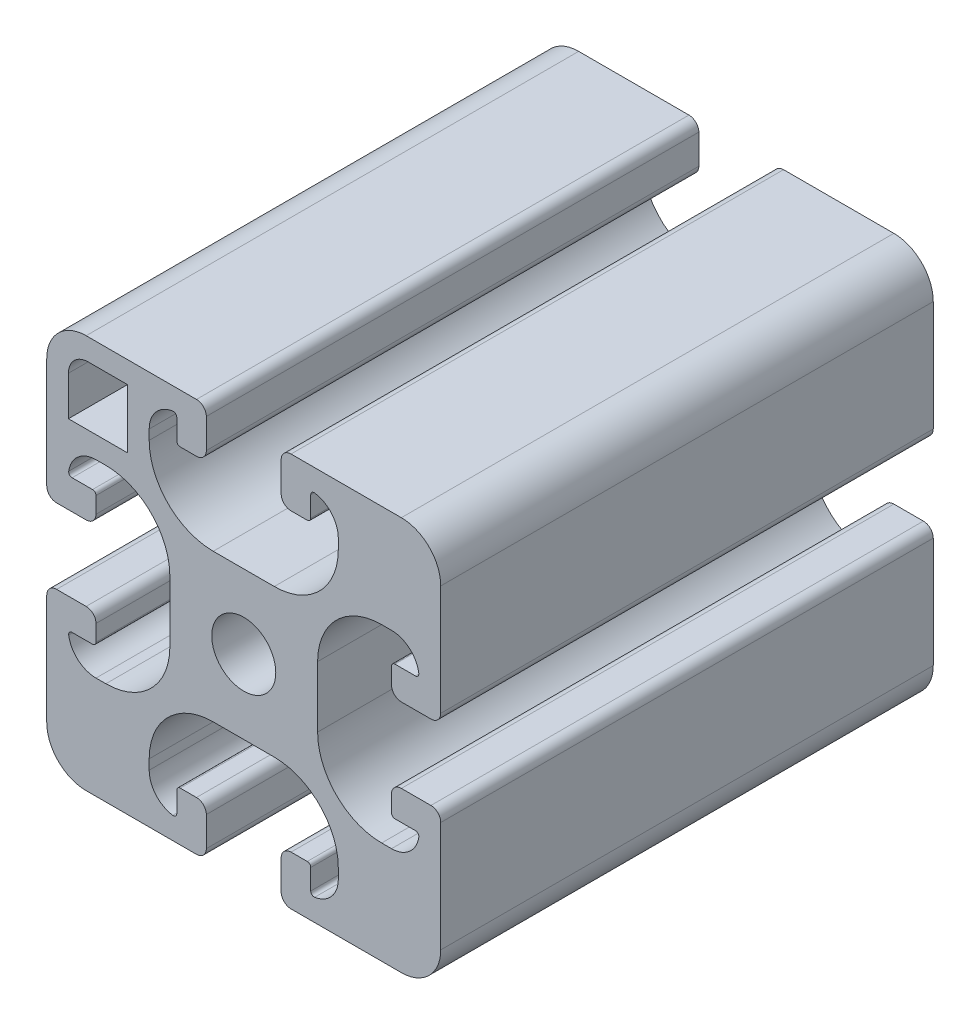
from build123d import *
from build123d.topology import SkipClean

# Parameters (mm, degrees)
Y_KSEKLIK_EKSTR_ZYON1_DEPTH = 50


with BuildPart() as part:
    # Çizim1 → Yükseklik-Ekstrüzyon1 (new body)
    # profile 1 of 4: a face of its own
    with SkipClean():  # the faces are left unmerged after this step: merging them gives an invalid solid
        with BuildSketch(Plane.XY):
            with BuildLine():
                ThreePointArc((-20, 16), (-18.828427125, 18.828427125), (-16, 20))
                Line((-16, 20), (-4.8, 20))
                ThreePointArc((-4.8, 20), (-4.092893219, 19.707106781), (-3.8, 19))
                Line((-3.8, 19), (-3.8, 16))
                ThreePointArc((-3.8, 16), (-4.092893219, 15.292893219), (-4.8, 15))
                Line((-4.8, 15), (-6.45, 15))
                ThreePointArc((-6.45, 15), (-6.697487373, 15.102512627), (-6.8, 15.35))
                Line((-6.8, 15.35), (-6.8, 17.424871131))
                ThreePointArc((-6.8, 17.424871131), (-6.920871215, 17.689446262), (-7.2, 17.771281292))
                ThreePointArc((-7.2, 17.771281292), (-8.916601049, 16.833030278), (-9.6, 15))
                Line((-9.6, 15), (-9.6, 14))
                ThreePointArc((-9.6, 14), (-7.696194078, 9.403805922), (-3.1, 7.5))
                Line((-3.1, 7.5), (0, 7.5))
                Line((0, 7.5), (0, 3.25))
                ThreePointArc((0, 3.25), (-2.298097039, 2.298097039), (-3.25, 0))
                Line((-3.25, 0), (-7.5, 0))
                Line((-7.5, 0), (-7.5, 3.1))
                ThreePointArc((-7.5, 3.1), (-9.403805922, 7.696194078), (-14, 9.6))
                Line((-14, 9.6), (-15, 9.6))
                ThreePointArc((-15, 9.6), (-16.833030278, 8.916601049), (-17.771281292, 7.2))
                ThreePointArc((-17.771281292, 7.2), (-17.689446262, 6.920871215), (-17.424871131, 6.8))
                Line((-17.424871131, 6.8), (-15.35, 6.8))
                ThreePointArc((-15.35, 6.8), (-15.102512627, 6.697487373), (-15, 6.45))
                Line((-15, 6.45), (-15, 4.8))
                ThreePointArc((-15, 4.8), (-15.292893219, 4.092893219), (-16, 3.8))
                Line((-16, 3.8), (-19, 3.8))
                ThreePointArc((-19, 3.8), (-19.707106781, 4.092893219), (-20, 4.8))
                Line((-20, 4.8), (-20, 16))
            make_face()
            with BuildLine():
                ThreePointArc((-15.8, 17.8), (-17.214213562, 17.214213562), (-17.8, 15.8))
                Line((-17.8, 15.8), (-17.8, 11.8))
                Line((-17.8, 11.8), (-11.8, 11.8))
                Line((-11.8, 11.8), (-11.8, 17.8))
                Line((-11.8, 17.8), (-15.8, 17.8))
            make_face(mode=Mode.SUBTRACT)
        # profile 2 of 4: a face of its own
        with BuildSketch(Plane.XY):
            with BuildLine():
                Line((16, 3.8), (19, 3.8))
                ThreePointArc((19, 3.8), (19.707106781, 4.092893219), (20, 4.8))
                Line((20, 4.8), (20, 16))
                ThreePointArc((20, 16), (18.828427125, 18.828427125), (16, 20))
                Line((16, 20), (4.8, 20))
                ThreePointArc((4.8, 20), (4.092893219, 19.707106781), (3.8, 19))
                Line((3.8, 19), (3.8, 16))
                ThreePointArc((3.8, 16), (4.092893219, 15.292893219), (4.8, 15))
                Line((4.8, 15), (6.45, 15))
                ThreePointArc((6.45, 15), (6.697487373, 15.102512627), (6.8, 15.35))
                Line((6.8, 15.35), (6.8, 17.424871131))
                ThreePointArc((6.8, 17.424871131), (6.920871215, 17.689446262), (7.2, 17.771281292))
                ThreePointArc((7.2, 17.771281292), (8.916601049, 16.833030278), (9.6, 15))
                Line((9.6, 15), (9.6, 14))
                ThreePointArc((9.6, 14), (7.696194078, 9.403805922), (3.1, 7.5))
                Line((3.1, 7.5), (0, 7.5))
                Line((0, 7.5), (0, 3.25))
                ThreePointArc((0, 3.25), (2.298097039, 2.298097039), (3.25, 0))
                Line((3.25, 0), (7.5, 0))
                Line((7.5, 0), (7.5, 3.1))
                ThreePointArc((7.5, 3.1), (9.403805922, 7.696194078), (14, 9.6))
                Line((14, 9.6), (15, 9.6))
                ThreePointArc((15, 9.6), (16.833030278, 8.916601049), (17.771281292, 7.2))
                ThreePointArc((17.771281292, 7.2), (17.689446262, 6.920871215), (17.424871131, 6.8))
                Line((17.424871131, 6.8), (15.35, 6.8))
                ThreePointArc((15.35, 6.8), (15.102512627, 6.697487373), (15, 6.45))
                Line((15, 6.45), (15, 4.8))
                ThreePointArc((15, 4.8), (15.292893219, 4.092893219), (16, 3.8))
            make_face()
        # profile 3 of 4: a face of its own
        with BuildSketch(Plane.XY):
            with BuildLine():
                Line((3.8, -16), (3.8, -19))
                ThreePointArc((3.8, -19), (4.092893219, -19.707106781), (4.8, -20))
                Line((4.8, -20), (16, -20))
                ThreePointArc((16, -20), (18.828427125, -18.828427125), (20, -16))
                Line((20, -16), (20, -4.8))
                ThreePointArc((20, -4.8), (19.707106781, -4.092893219), (19, -3.8))
                Line((19, -3.8), (16, -3.8))
                ThreePointArc((16, -3.8), (15.292893219, -4.092893219), (15, -4.8))
                Line((15, -4.8), (15, -6.45))
                ThreePointArc((15, -6.45), (15.102512627, -6.697487373), (15.35, -6.8))
                Line((15.35, -6.8), (17.424871131, -6.8))
                ThreePointArc((17.424871131, -6.8), (17.689446262, -6.920871215), (17.771281292, -7.2))
                ThreePointArc((17.771281292, -7.2), (16.833030278, -8.916601049), (15, -9.6))
                Line((15, -9.6), (14, -9.6))
                ThreePointArc((14, -9.6), (9.403805922, -7.696194078), (7.5, -3.1))
                Line((7.5, -3.1), (7.5, 0))
                Line((7.5, 0), (3.25, 0))
                ThreePointArc((3.25, 0), (2.298097039, -2.298097039), (0, -3.25))
                Line((0, -3.25), (0, -7.5))
                Line((0, -7.5), (3.1, -7.5))
                ThreePointArc((3.1, -7.5), (7.696194078, -9.403805922), (9.6, -14))
                Line((9.6, -14), (9.6, -15))
                ThreePointArc((9.6, -15), (8.916601049, -16.833030278), (7.2, -17.771281292))
                ThreePointArc((7.2, -17.771281292), (6.920871215, -17.689446262), (6.8, -17.424871131))
                Line((6.8, -17.424871131), (6.8, -15.35))
                ThreePointArc((6.8, -15.35), (6.697487373, -15.102512627), (6.45, -15))
                Line((6.45, -15), (4.8, -15))
                ThreePointArc((4.8, -15), (4.092893219, -15.292893219), (3.8, -16))
            make_face()
        # profile 4 of 4: a face of its own
        with BuildSketch(Plane.XY):
            with BuildLine():
                Line((-16, -3.8), (-19, -3.8))
                ThreePointArc((-19, -3.8), (-19.707106781, -4.092893219), (-20, -4.8))
                Line((-20, -4.8), (-20, -16))
                ThreePointArc((-20, -16), (-18.828427125, -18.828427125), (-16, -20))
                Line((-16, -20), (-4.8, -20))
                ThreePointArc((-4.8, -20), (-4.092893219, -19.707106781), (-3.8, -19))
                Line((-3.8, -19), (-3.8, -16))
                ThreePointArc((-3.8, -16), (-4.092893219, -15.292893219), (-4.8, -15))
                Line((-4.8, -15), (-6.45, -15))
                ThreePointArc((-6.45, -15), (-6.697487373, -15.102512627), (-6.8, -15.35))
                Line((-6.8, -15.35), (-6.8, -17.424871131))
                ThreePointArc((-6.8, -17.424871131), (-6.920871215, -17.689446262), (-7.2, -17.771281292))
                ThreePointArc((-7.2, -17.771281292), (-8.916601049, -16.833030278), (-9.6, -15))
                Line((-9.6, -15), (-9.6, -14))
                ThreePointArc((-9.6, -14), (-7.696194078, -9.403805922), (-3.1, -7.5))
                Line((-3.1, -7.5), (0, -7.5))
                Line((0, -7.5), (0, -3.25))
                ThreePointArc((0, -3.25), (-2.298097039, -2.298097039), (-3.25, 0))
                Line((-3.25, 0), (-7.5, 0))
                Line((-7.5, 0), (-7.5, -3.1))
                ThreePointArc((-7.5, -3.1), (-9.403805922, -7.696194078), (-14, -9.6))
                Line((-14, -9.6), (-15, -9.6))
                ThreePointArc((-15, -9.6), (-16.833030278, -8.916601049), (-17.771281292, -7.2))
                ThreePointArc((-17.771281292, -7.2), (-17.689446262, -6.920871215), (-17.424871131, -6.8))
                Line((-17.424871131, -6.8), (-15.35, -6.8))
                ThreePointArc((-15.35, -6.8), (-15.102512627, -6.697487373), (-15, -6.45))
                Line((-15, -6.45), (-15, -4.8))
                ThreePointArc((-15, -4.8), (-15.292893219, -4.092893219), (-16, -3.8))
            make_face()
        extrude(amount=-Y_KSEKLIK_EKSTR_ZYON1_DEPTH)


solid = part.part
